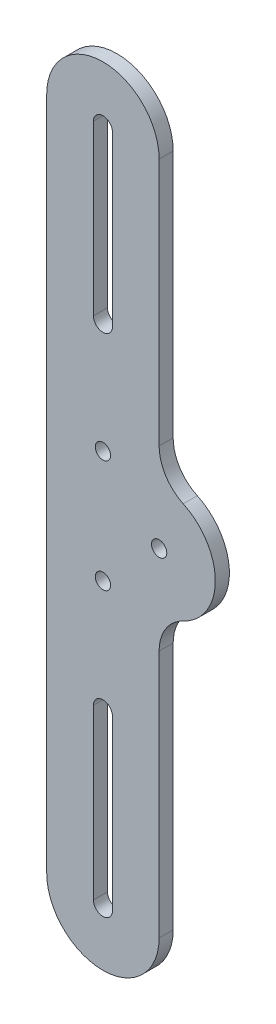
from build123d import *

# Parameters (mm, degrees)
SKETCH1_W             = 38.1
SKETCH1_H             = 177.8
BOSS_EXTRUDE1_DEPTH   = 1.5875
F_8_32_TAPPED_HOLE1_D = 3.4544
CUT_EXTRUDE1_DEPTH    = 91.973584765
SKETCH5_OUTSIDE_W     = 76.472
SKETCH5_OUTSIDE_H     = 216.172
CUT_EXTRUDE2_DEPTH    = 91.973584765


with BuildPart() as part:
    # Sketch1 → Boss-Extrude1 (new, symmetric)
    with BuildSketch(Plane.XY):
        Rectangle(SKETCH1_W, SKETCH1_H)
    extrude(amount=BOSS_EXTRUDE1_DEPTH, both=True)

    # #8-32 Tapped Hole1 (through all)
    with Locations(Plane.XY.offset(1.5875)):
        with Locations((-6.35, 12.7), (-6.35, -12.7), (6.35, 0)):
            Hole(F_8_32_TAPPED_HOLE1_D / 2)

    # Sketch4 → Cut-Extrude1 (cut, through all)
    with BuildSketch(Plane.XY.offset(1.5875)):
        with BuildLine():
            Line((-4.20116, 76.2), (-4.20116, 38.1))
            ThreePointArc((-4.20116, 38.1), (-6.35, 35.95116), (-8.49884, 38.1))
            Line((-8.49884, 38.1), (-8.49884, 76.2))
            ThreePointArc((-8.49884, 76.2), (-6.35, 78.34884), (-4.20116, 76.2))
        make_face()
        with BuildLine():
            Line((-4.20116, -38.1), (-4.20116, -76.2))
            ThreePointArc((-4.20116, -76.2), (-6.35, -78.34884), (-8.49884, -76.2))
            Line((-8.49884, -76.2), (-8.49884, -38.1))
            ThreePointArc((-8.49884, -38.1), (-6.35, -35.95116), (-4.20116, -38.1))
        make_face()
    extrude(amount=-CUT_EXTRUDE1_DEPTH, mode=Mode.SUBTRACT)

    # Sketch5 outside → Cut-Extrude2 (cut, through all)
    with BuildSketch(Plane.XY.offset(1.5875)):
        Rectangle(SKETCH5_OUTSIDE_W, SKETCH5_OUTSIDE_H)
        with BuildLine():
            Line((6.35, 76.2), (6.35, 20.080463142))
            ThreePointArc((6.35, 20.080463142), (7.824905724, 14.989136484), (11.792857143, 11.474550367))
            ThreePointArc((11.792857143, 11.474550367), (19.05, 0), (11.792857143, -11.474550367))
            ThreePointArc((11.792857143, -11.474550367), (7.824905724, -14.989136484), (6.35, -20.080463142))
            Line((6.35, -20.080463142), (6.35, -76.2))
            ThreePointArc((6.35, -76.2), (-6.35, -88.9), (-19.05, -76.2))
            Line((-19.05, -76.2), (-19.05, 76.2))
            ThreePointArc((-19.05, 76.2), (-6.35, 88.9), (6.35, 76.2))
        make_face(mode=Mode.SUBTRACT)
    extrude(amount=-CUT_EXTRUDE2_DEPTH, mode=Mode.SUBTRACT)


solid = part.part
